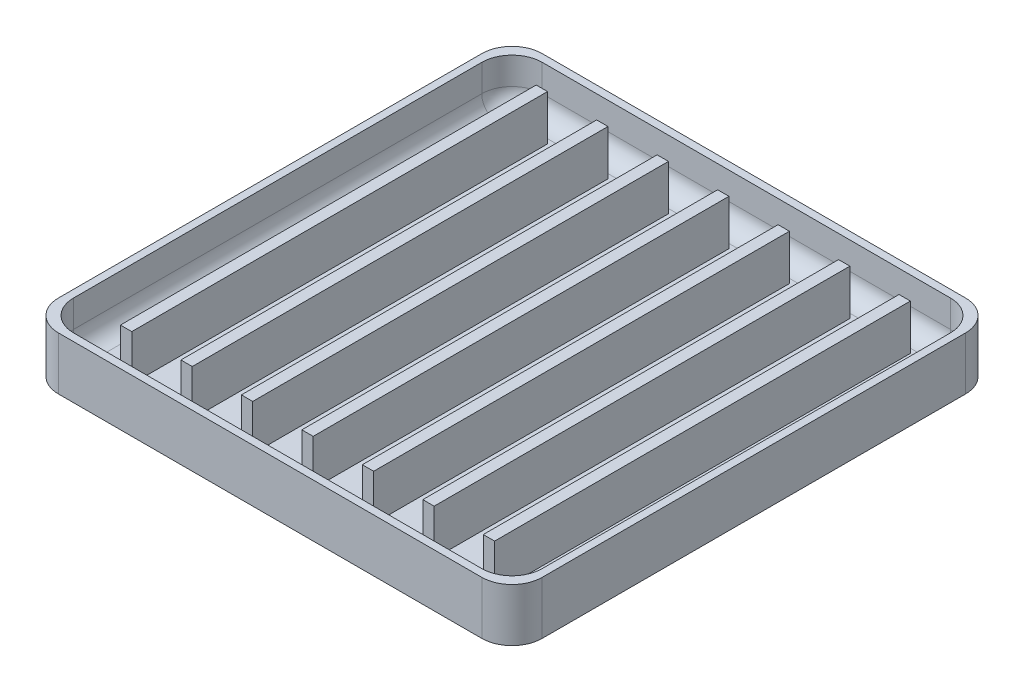
from build123d import *

# Parameters (mm, degrees)
ESQUISSE1_W                = 101.6
ESQUISSE1_H                = 101.6
BOSS_EXTRU_1_DEPTH         = 11.1125
CONG_1_R                   = 6.35
ENL_V_MAT_EXTRU_1_DEPTH    = 9.525
ESQUISSE4_W                = 2.38125
ESQUISSE4_H                = 87.3125
BOSS_EXTRU_3_DEPTH         = 9.525
R_P_TITION_LIN_AIRE1_COUNT = 7
R_P_TITION_LIN_AIRE1_PITCH = 12.7
CONG_2_R                   = 3.81


with BuildPart() as part:
    # Esquisse1 → Boss.-Extru.1 (new body)
    with BuildSketch(Plane(origin=(0, 0, 0), x_dir=(1, 0, 0), z_dir=(0, 1, 0))):
        Rectangle(ESQUISSE1_W, ESQUISSE1_H)
    extrude(amount=BOSS_EXTRU_1_DEPTH)

    # Congé1
    cong_1_edges = [part.edges().sort_by_distance(p)[0] for p in [
        (50.8, 5.55625, 50.8),
        (-50.8, 5.55625, 50.8),
        (-50.8, 5.55625, -50.8),
        (50.8, 5.55625, -50.8),
    ]]
    fillet(cong_1_edges, radius=CONG_1_R)

    # Esquisse2 → Enlèv. mat.-Extru.1 (cut)
    with BuildSketch(Plane(origin=(0, 11.1125, 0), x_dir=(1, 0, 0), z_dir=(0, 1, 0))):
        with BuildLine():
            Line((-42.8625, 49.2125), (42.8625, 49.2125))
            ThreePointArc((42.8625, 49.2125), (47.352628061, 47.352628061), (49.2125, 42.8625))
            Line((49.2125, 42.8625), (49.2125, -42.8625))
            ThreePointArc((49.2125, -42.8625), (47.352628061, -47.352628061), (42.8625, -49.2125))
            Line((42.8625, -49.2125), (-42.8625, -49.2125))
            ThreePointArc((-42.8625, -49.2125), (-47.352628061, -47.352628061), (-49.2125, -42.8625))
            Line((-49.2125, -42.8625), (-49.2125, 42.8625))
            ThreePointArc((-49.2125, 42.8625), (-47.352628061, 47.352628061), (-42.8625, 49.2125))
        make_face()
    extrude(amount=-ENL_V_MAT_EXTRU_1_DEPTH, mode=Mode.SUBTRACT)

    # Esquisse4 → Boss.-Extru.3 (add)
    with BuildSketch(Plane(origin=(0, 1.5875, 0), x_dir=(1, 0, 0), z_dir=(0, 1, 0))):
        with Locations((-38.179375, 0.79375)):
            Rectangle(ESQUISSE4_W, ESQUISSE4_H)
    boss_extru_3 = extrude(amount=BOSS_EXTRU_3_DEPTH)

    # Répétition linéaire1: Boss.-Extru.3 ×7
    with Locations(*[(i * R_P_TITION_LIN_AIRE1_PITCH, 0, 0) for i in range(1, R_P_TITION_LIN_AIRE1_COUNT)]):
        add(boss_extru_3)

    # Congé2
    cong_2_edges = [part.edges().sort_by_distance(p)[0] for p in [
        (-47.352628061, 1.5875, 47.352628061),
        (-49.2125, 1.5875, 0),
        (-47.352628061, 1.5875, -47.352628061),
        (0, 1.5875, -49.2125),
        (47.352628061, 1.5875, -47.352628061),
        (49.2125, 1.5875, 0),
        (47.352628061, 1.5875, 47.352628061),
        (0, 1.5875, 49.2125),
    ]]
    fillet(cong_2_edges, radius=CONG_2_R)


solid = part.part
